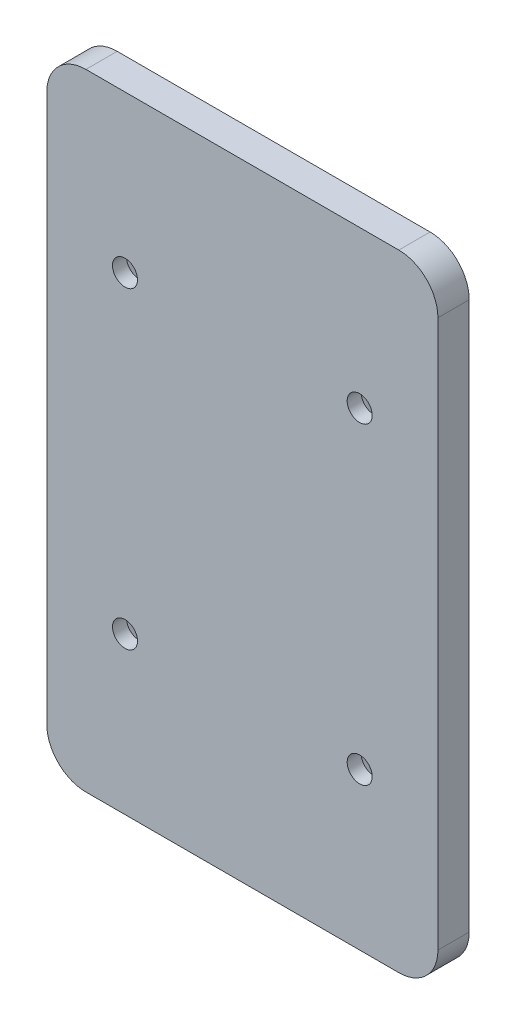
from build123d import *

# Parameters (mm, degrees)
DODANIE_WYCI_GNI_CIE1_DEPTH = 4
WYTNIJ_WYCI_GNI_CIE1_REACH  = 49.339
SZKIC2_R                    = 1.6
SZKIC3_R                    = 1.6
WYTNIJ_WYCI_GNI_CIE2_DEPTH  = 2.2


with BuildPart() as part:
    # Szkic1 → Dodanie-wyciągnięcie1 (new body)
    with BuildSketch(Plane.XY):
        with BuildLine():
            Line((-20, -40), (20, -40))
            ThreePointArc((20, -40), (23.535533906, -38.535533906), (25, -35))
            Line((25, -35), (25, 35))
            ThreePointArc((25, 35), (23.535533906, 38.535533906), (20, 40))
            Line((20, 40), (-20, 40))
            ThreePointArc((-20, 40), (-23.535533906, 38.535533906), (-25, 35))
            Line((-25, 35), (-25, -35))
            ThreePointArc((-25, -35), (-23.535533906, -38.535533906), (-20, -40))
        make_face()
    extrude(amount=DODANIE_WYCI_GNI_CIE1_DEPTH)

    # Szkic2 → Wytnij-wyciągnięcie1 (cut, up to next)
    with BuildSketch(Plane(origin=(0, 0, 0), x_dir=(-1, 0, 0), z_dir=(0, 0, -1)), mode=Mode.PRIVATE) as wytnij_wyci_gni_cie1_sk1:
        with Locations((-15, 20)):
            Circle(SZKIC2_R)
    wytnij_wyci_gni_cie1_tool1 = extrude(wytnij_wyci_gni_cie1_sk1.sketch, amount=-WYTNIJ_WYCI_GNI_CIE1_REACH, mode=Mode.PRIVATE) & part.part
    # Szkic2 → Wytnij-wyciągnięcie1 (cut, up to next)
    with BuildSketch(Plane(origin=(0, 0, 0), x_dir=(-1, 0, 0), z_dir=(0, 0, -1)), mode=Mode.PRIVATE) as wytnij_wyci_gni_cie1_sk2:
        with Locations(Location((15, 20, 0), (0, 0, 180))):
            Circle(SZKIC2_R)
    wytnij_wyci_gni_cie1_tool2 = extrude(wytnij_wyci_gni_cie1_sk2.sketch, amount=-WYTNIJ_WYCI_GNI_CIE1_REACH, mode=Mode.PRIVATE) & part.part
    # Szkic2 → Wytnij-wyciągnięcie1 (cut, up to next)
    with BuildSketch(Plane(origin=(0, 0, 0), x_dir=(-1, 0, 0), z_dir=(0, 0, -1)), mode=Mode.PRIVATE) as wytnij_wyci_gni_cie1_sk3:
        with Locations((15, -20)):
            Circle(SZKIC2_R)
    wytnij_wyci_gni_cie1_tool3 = extrude(wytnij_wyci_gni_cie1_sk3.sketch, amount=-WYTNIJ_WYCI_GNI_CIE1_REACH, mode=Mode.PRIVATE) & part.part
    # Szkic2 → Wytnij-wyciągnięcie1 (cut, up to next)
    with BuildSketch(Plane(origin=(0, 0, 0), x_dir=(-1, 0, 0), z_dir=(0, 0, -1)), mode=Mode.PRIVATE) as wytnij_wyci_gni_cie1_sk4:
        with Locations(Location((-15, -20, 0), (0, 0, 180))):
            Circle(SZKIC2_R)
    wytnij_wyci_gni_cie1_tool4 = extrude(wytnij_wyci_gni_cie1_sk4.sketch, amount=-WYTNIJ_WYCI_GNI_CIE1_REACH, mode=Mode.PRIVATE) & part.part
    add(wytnij_wyci_gni_cie1_tool1.solids().sort_by_distance((15, 20, 0))[0], mode=Mode.SUBTRACT)
    add(wytnij_wyci_gni_cie1_tool2.solids().sort_by_distance((-15, 20, 0))[0], mode=Mode.SUBTRACT)
    add(wytnij_wyci_gni_cie1_tool3.solids().sort_by_distance((-15, -20, 0))[0], mode=Mode.SUBTRACT)
    add(wytnij_wyci_gni_cie1_tool4.solids().sort_by_distance((15, -20, 0))[0], mode=Mode.SUBTRACT)

    # Szkic3 → Wytnij-wyciągnięcie2 (cut)
    # profile 1 of 4: a face of its own
    with BuildSketch(Plane(origin=(0, 0, 0), x_dir=(-1, 0, 0), z_dir=(0, 0, -1))):
        Polygon((-11.709103466, 20), (-13.354551733, 22.85), (-16.645448267, 22.85), (-18.290896534, 20), (-16.645448267, 17.15), (-13.354551733, 17.15), align=None)
        with Locations((-15, 20)):
            Circle(SZKIC3_R, mode=Mode.SUBTRACT)
    # profile 2 of 4: a face of its own
    with BuildSketch(Plane(origin=(0, 0, 0), x_dir=(-1, 0, 0), z_dir=(0, 0, -1))):
        Polygon((13.354551733, 17.15), (11.709103466, 20), (13.354551733, 22.85), (16.645448267, 22.85), (18.290896534, 20), (16.645448267, 17.15), align=None)
        with Locations(Location((15, 20, 0), (0, 0, 180))):
            Circle(SZKIC3_R, mode=Mode.SUBTRACT)
    # profile 3 of 4: a face of its own
    with BuildSketch(Plane(origin=(0, 0, 0), x_dir=(-1, 0, 0), z_dir=(0, 0, -1))):
        Polygon((11.709103466, -20), (13.354551733, -22.85), (16.645448267, -22.85), (18.290896534, -20), (16.645448267, -17.15), (13.354551733, -17.15), align=None)
        with Locations((15, -20)):
            Circle(SZKIC3_R, mode=Mode.SUBTRACT)
    # profile 4 of 4: a face of its own
    with BuildSketch(Plane(origin=(0, 0, 0), x_dir=(-1, 0, 0), z_dir=(0, 0, -1))):
        Polygon((-13.354551733, -17.15), (-11.709103466, -20), (-13.354551733, -22.85), (-16.645448267, -22.85), (-18.290896534, -20), (-16.645448267, -17.15), align=None)
        with Locations(Location((-15, -20, 0), (0, 0, 180))):
            Circle(SZKIC3_R, mode=Mode.SUBTRACT)
    extrude(amount=-WYTNIJ_WYCI_GNI_CIE2_DEPTH, mode=Mode.SUBTRACT)


solid = part.part
